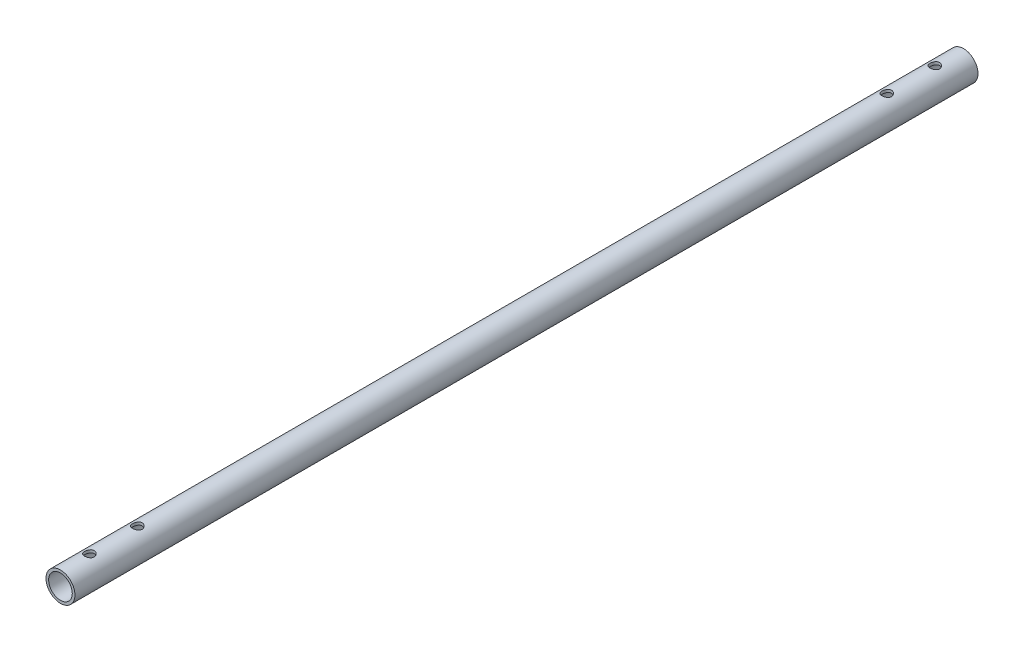
from build123d import *

# Parameters (mm, degrees)
SKETCH1_R           = 30.15
SKETCH1_R_2         = 24.61
EXTRUDE_THIN1_DEPTH = 940
SKETCH2_R           = 10.05
CUT_EXTRUDE1_DEPTH  = 941.96654829


with BuildPart() as part:
    # Sketch1 → Extrude-Thin1 (new, symmetric)
    with BuildSketch(Plane.XY):
        Circle(SKETCH1_R)
        Circle(SKETCH1_R_2, mode=Mode.SUBTRACT)
    extrude(amount=EXTRUDE_THIN1_DEPTH, both=True)

    # Sketch2 → Cut-Extrude1 (cut, symmetric)
    with BuildSketch(Plane(origin=(0, 0, 0), x_dir=(1, 0, 0), z_dir=(0, 1, 0))):
        with Locations(Location((0, 880, 0), (0, 0, 270))):
            Circle(SKETCH2_R)
        with Locations(Location((0, 780, 0), (0, 0, 270))):
            Circle(SKETCH2_R)
    cut_extrude1 = extrude(amount=CUT_EXTRUDE1_DEPTH, both=True, mode=Mode.SUBTRACT)

    # Mirror1: Cut-Extrude1 across plane
    add(cut_extrude1.mirror(Plane.XY), mode=Mode.SUBTRACT)


solid = part.part
